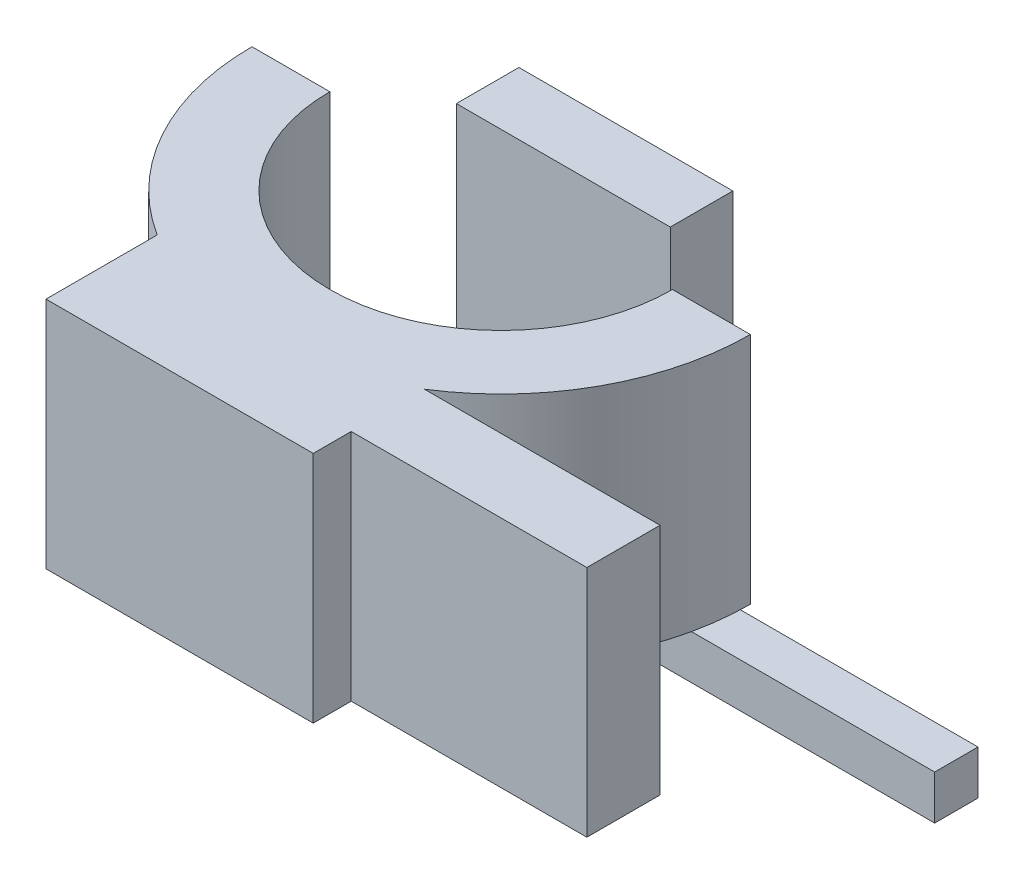
from build123d import *

# Parameters (mm, degrees)
BOSS_EXTRUDE1_DEPTH   = 25.4
SKETCH3_W             = 27.465648235
SKETCH3_H             = 8.029689019
BOSS_EXTRUDE1_2_DEPTH = 25.4
BOSS_EXTRUDE3_START   = -30
BOSS_EXTRUDE3_DEPTH   = 30
SKETCH11_W            = 4.815186011
SKETCH11_H            = 5.567324058
BOSS_EXTRUDE7_DEPTH   = 25
SKETCH12_W            = 5.567324058
SKETCH12_H            = 5.682782698
BOSS_EXTRUDE10_DEPTH  = 45


with BuildPart() as part:
    # Sketch3 → Boss-Extrude1 (new body)
    with BuildSketch(Plane(origin=(0, 0, 0), x_dir=(1, 0, 0), z_dir=(0, 1, 0))):
        with BuildLine():
            Line((-32, 0), (-22, 0))
            ThreePointArc((-22, 0), (0, -22), (22, 0))
            Line((22, 0), (32, 0))
            ThreePointArc((32, 0), (28.045035802, -15.410255249), (17.157752073, -27.011322511))
            Line((17.157752073, -27.011322511), (17.157752073, -33.11424945))
            Line((17.157752073, -33.11424945), (4.438736665, -33.11424945))
            Line((4.438736665, -33.11424945), (-17.157752073, -33.11424945))
            Line((-17.157752073, -33.11424945), (-17.157752073, -27.011322511))
            ThreePointArc((-17.157752073, -27.011322511), (-28.045035802, -15.410255249), (-32, 0))
        make_face()
    extrude(amount=BOSS_EXTRUDE1_DEPTH)

    # Sketch6 → Boss-Extrude3 (add)
    with BuildSketch(Plane(origin=(0, 25.4, 0), x_dir=(1, 0, 0), z_dir=(0, 1, 0)).offset(BOSS_EXTRUDE3_START)):
        with BuildLine():
            Line((17.157752073, -27.011322511), (37.157752073, -27.011322511))
            Line((37.157752073, -27.011322511), (47.416343202, -27.011322511))
            Line((47.416343202, -27.011322511), (47.416343202, -33.11424945))
            Line((47.416343202, -33.11424945), (47.416343202, -36.4107034))
            Line((47.416343202, -36.4107034), (17.157752073, -36.4107034))
            Line((17.157752073, -36.4107034), (17.157752073, -41.289729226))
            Line((17.157752073, -41.289729226), (-17.157752073, -41.289729226))
            Line((-17.157752073, -41.289729226), (-17.157752073, -33.11424945))
            Line((-17.157752073, -33.11424945), (-17.157752073, -27.011322511))
            ThreePointArc((-17.157752073, -27.011322511), (-28.045035802, -15.410255249), (-32, 0))
            Line((-32, 0), (-22, 0))
            ThreePointArc((-22, 0), (0, -22), (22, 0))
            Line((22, 0), (32, 0))
            ThreePointArc((32, 0), (28.045035802, -15.410255249), (17.157752073, -27.011322511))
        make_face()
    extrude(amount=BOSS_EXTRUDE3_DEPTH)


with BuildPart() as body_2:
    # Sketch3 → Boss-Extrude1 2 (new body)
    with BuildSketch(Plane(origin=(0, 0, 0), x_dir=(1, 0, 0), z_dir=(0, 1, 0))):
        with Locations((1.17728503, 10.821309715)):
            Rectangle(SKETCH3_W, SKETCH3_H)
    extrude(amount=BOSS_EXTRUDE1_2_DEPTH)

    # Sketch11 → Boss-Extrude7 (add)
    with BuildSketch(Plane(origin=(0, 0, 0), x_dir=(-1, 0, 0), z_dir=(0, -1, 0))):
        with Locations((-0.365879556, 10.676539537)):
            Rectangle(SKETCH11_W, SKETCH11_H)
    extrude(amount=BOSS_EXTRUDE7_DEPTH)

    # Sketch12 → Boss-Extrude10 (add)
    with BuildSketch(Plane(origin=(2.773472561, 0, 0), x_dir=(0, 0, -1), z_dir=(1, 0, 0))):
        with Locations((10.676539537, -22.158608651)):
            Rectangle(SKETCH12_W, SKETCH12_H)
    extrude(amount=BOSS_EXTRUDE10_DEPTH)


solid = Compound([part.part, body_2.part])
